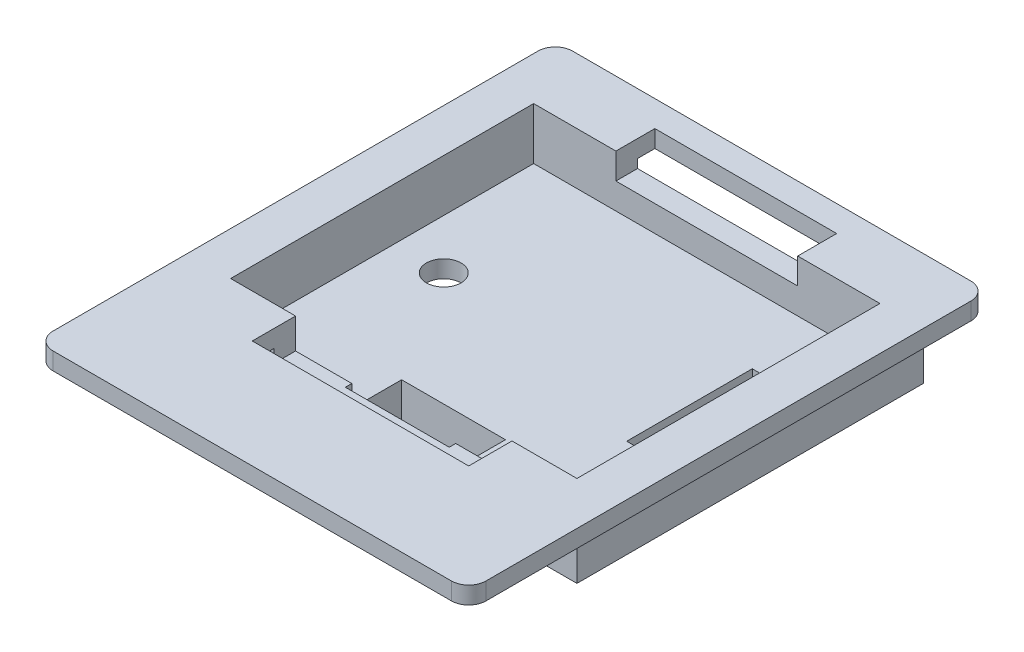
from build123d import *

# Parameters (mm, degrees)
SKETCH1_W               = 50
SKETCH1_H               = 60
BOSS_EXTRUDE1_DEPTH     = 15
FILLET1_R               = 2
SKETCH2_W               = 40
SKETCH2_H               = 35
CUT_EXTRUDE1_DEPTH      = 6
SKETCH3_W               = 4
SKETCH3_H               = 14.5
CUT_EXTRUDE2_DEPTH      = 10
SKETCH4_R               = 2
CUT_EXTRUDE3_DEPTH      = 10
CUT_EXTRUDE4_DEPTH      = 5
CUT_EXTRUDE4_DEPTH_BACK = 6
SKETCH5_W               = 12
SKETCH5_H               = 6.5
SKETCH6_R               = 3.2
CUT_EXTRUDE5_DEPTH      = 8
SKETCH7_W               = 25
SKETCH7_H               = 10
CUT_EXTRUDE6_DEPTH      = 3.5
SKETCH8_W               = 51.392130936
SKETCH8_H               = 62.084358578
SKETCH8_W_2             = 45
SKETCH8_H_2             = 40
CUT_EXTRUDE7_DEPTH      = 13
SKETCH9_W               = 21
SKETCH9_H               = 9
CUT_EXTRUDE8_DEPTH      = 3
CUT_EXTRUDE9_DEPTH      = 7
FILLET2_R               = 5


with BuildPart() as part:
    # Sketch1 → Boss-Extrude1 (new body)
    with BuildSketch(Plane(origin=(0, 0, 0), x_dir=(1, 0, 0), z_dir=(0, 1, 0))):
        Rectangle(SKETCH1_W, SKETCH1_H)
    extrude(amount=BOSS_EXTRUDE1_DEPTH)

    # Fillet1
    fillet1_edges = [part.edges().sort_by_distance(p)[0] for p in [
        (25, 7.5, 30),
        (-25, 7.5, 30),
        (-25, 7.5, -30),
        (25, 7.5, -30),
    ]]
    fillet(fillet1_edges, radius=FILLET1_R)

    # Sketch2 → Cut-Extrude1 (cut)
    with BuildSketch(Plane(origin=(0, 15, 0), x_dir=(1, 0, 0), z_dir=(0, 1, 0))):
        with Locations((0, 5)):
            Rectangle(SKETCH2_W, SKETCH2_H)
    extrude(amount=-CUT_EXTRUDE1_DEPTH, mode=Mode.SUBTRACT)

    # Sketch3 → Cut-Extrude2 (cut)
    with BuildSketch(Plane(origin=(0, 9, 0), x_dir=(1, 0, 0), z_dir=(0, 1, 0))):
        with Locations((15.15, 7.35)):
            Rectangle(SKETCH3_W, SKETCH3_H)
    extrude(amount=-CUT_EXTRUDE2_DEPTH, mode=Mode.SUBTRACT)

    # Sketch4 → Cut-Extrude3 (cut)
    with BuildSketch(Plane.XZ):
        with Locations(Location((-14.251980034, -6.369003384, 0), (0, 0, 270))):
            Circle(SKETCH4_R)
    extrude(amount=-CUT_EXTRUDE3_DEPTH, mode=Mode.SUBTRACT)

    # Sketch5 → Cut-Extrude4 (cut, two sides: drawn at the far end of the back side and taken through both)
    with BuildSketch(Plane(origin=(0, 9, 0), x_dir=(1, 0, 0), z_dir=(0, 1, 0)).offset(-CUT_EXTRUDE4_DEPTH_BACK)):
        with Locations((0, -10)):
            Rectangle(SKETCH5_W, SKETCH5_H)
    extrude(amount=CUT_EXTRUDE4_DEPTH + CUT_EXTRUDE4_DEPTH_BACK, mode=Mode.SUBTRACT)

    # Sketch6 → Cut-Extrude5 (cut)
    with BuildSketch(Plane.XZ):
        with Locations(Location((0, 10, 0), (0, 0, 270))):
            Circle(SKETCH6_R)
    extrude(amount=-CUT_EXTRUDE5_DEPTH, mode=Mode.SUBTRACT)

    # Sketch7 → Cut-Extrude6 (cut)
    with BuildSketch(Plane(origin=(0, 15, 0), x_dir=(1, 0, 0), z_dir=(0, 1, 0))):
        with Locations((0, -12.5)):
            Rectangle(SKETCH7_W, SKETCH7_H)
    extrude(amount=-CUT_EXTRUDE6_DEPTH, mode=Mode.SUBTRACT)

    # Sketch8 → Cut-Extrude7 (cut)
    with BuildSketch(Plane(origin=(0, 0, 0), x_dir=(-1, 0, 0), z_dir=(0, -1, 0))):
        Rectangle(SKETCH8_W, SKETCH8_H)
        with Locations((0, 5)):
            Rectangle(SKETCH8_W_2, SKETCH8_H_2, mode=Mode.SUBTRACT)
    extrude(amount=-CUT_EXTRUDE7_DEPTH, mode=Mode.SUBTRACT)

    # Sketch9 → Cut-Extrude8 (cut)
    with BuildSketch(Plane(origin=(0, 15, 0), x_dir=(1, 0, 0), z_dir=(0, 1, 0))):
        with Locations((0, 22.5)):
            Rectangle(SKETCH9_W, SKETCH9_H)
    extrude(amount=-CUT_EXTRUDE8_DEPTH, mode=Mode.SUBTRACT)

    # Sketch10 → Cut-Extrude9 (cut)
    with BuildSketch(Plane.XZ):
        with BuildLine():
            Line((22.5, 15), (7.5, 15))
            ThreePointArc((7.5, 15), (0, 2.5), (-7.5, 15))
            Line((-7.5, 15), (-22.5, 15))
            Line((-22.5, 15), (-22.5, -25))
            Line((-22.5, -25), (22.5, -25))
            Line((22.5, -25), (22.5, 15))
        make_face()
    extrude(amount=-CUT_EXTRUDE9_DEPTH, mode=Mode.SUBTRACT)

    # Fillet2
    fillet2_edges = [part.edges().sort_by_distance(p)[0] for p in [
        (0, 7, 2.5),
    ]]
    fillet(fillet2_edges, radius=FILLET2_R)


solid = part.part
